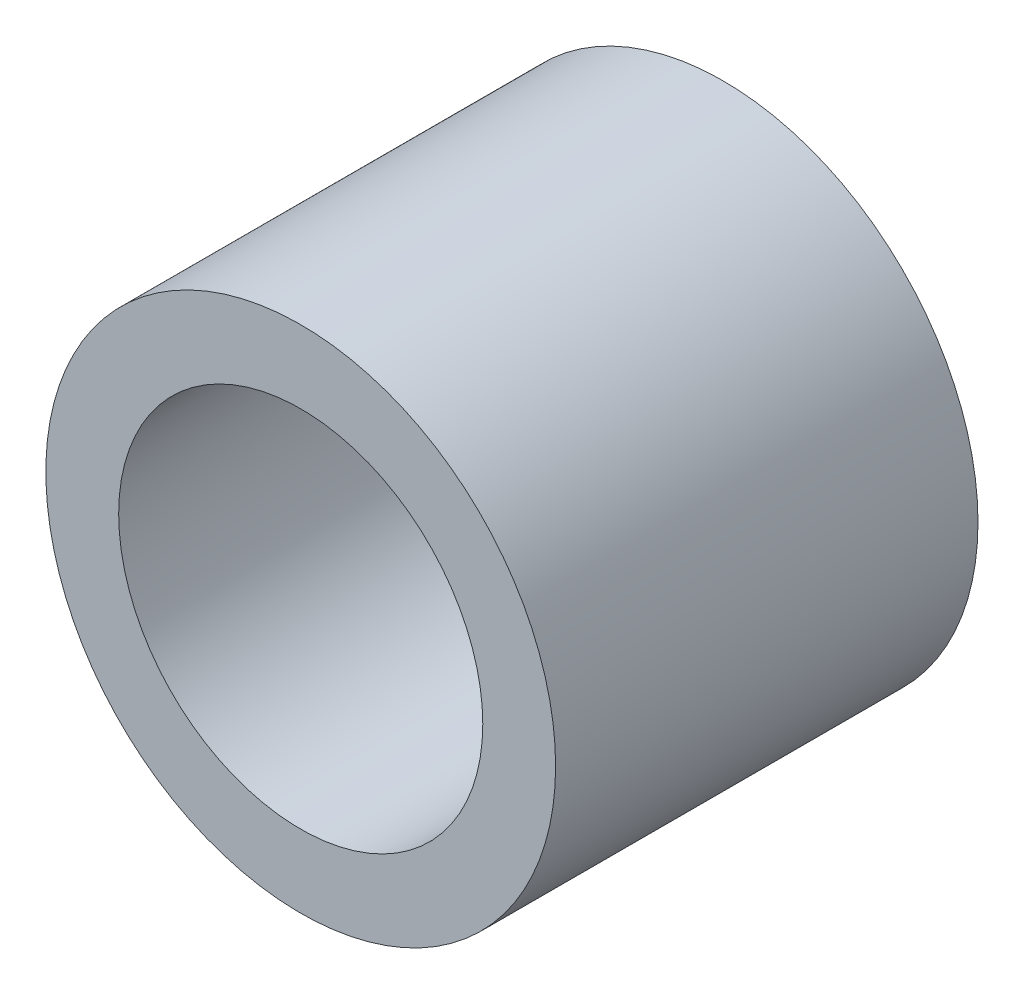
from build123d import *

# Parameters (mm, degrees)
SKETCH2_R           = 13.335
SKETCH2_R_2         = 9.525
BOSS_EXTRUDE1_DEPTH = 22.098


with BuildPart() as part:
    # Sketch2 → Boss-Extrude1 (new body)
    with BuildSketch(Plane.XY):
        Circle(SKETCH2_R)
        Circle(SKETCH2_R_2, mode=Mode.SUBTRACT)
    extrude(amount=BOSS_EXTRUDE1_DEPTH)


solid = part.part
